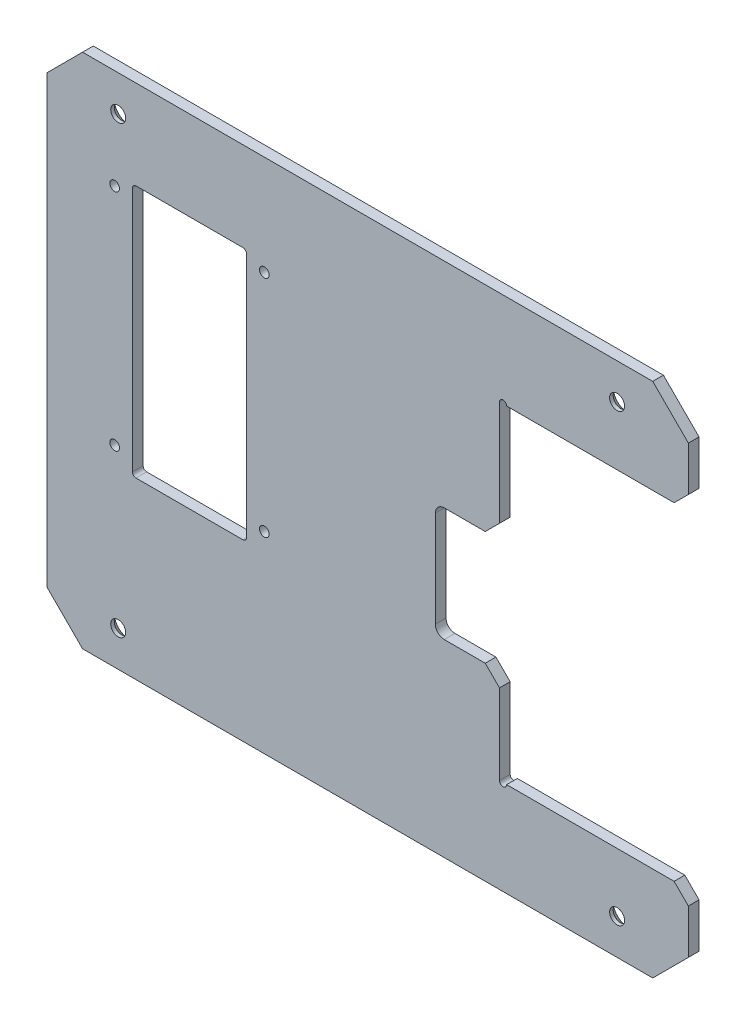
from build123d import *

# Parameters (mm, degrees)
SKETCH_1_W          = 180
SKETCH_1_H          = 145
EXTRUDE_1_DEPTH     = 1.5
SKETCH_2_R          = 2.1
SKETCH_2_W          = 53
SKETCH_2_H          = 92
CUT_EXTRUDE_1_DEPTH = 116.608174451
SKETCH_4_W          = 18
SKETCH_4_H          = 32
CUT_EXTRUDE_3_DEPTH = 116.608174451
SKETCH_3_R          = 1
CUT_EXTRUDE_2_DEPTH = 116.608174451
FILLET_1_R          = 2.5
CHAMFER_1_SIZE      = 2
CHAMFER_2_SIZE      = 10
CHAMFER_3_SIZE      = 4
SKETCH_5_R          = 1.35
SKETCH_5_W          = 32
SKETCH_5_H          = 71
CUT_EXTRUDE_4_DEPTH = 116.608174451
FILLET_2_R          = 1


with BuildPart() as part:
    # 草图1 → 凸台-拉伸1 (new, symmetric)
    with BuildSketch(Plane.XY):
        Rectangle(SKETCH_1_W, SKETCH_1_H)
    extrude(amount=EXTRUDE_1_DEPTH, both=True)

    # 草图2 → 切除-拉伸1 (cut, through all)
    with BuildSketch(Plane.XY.offset(1.5)):
        with Locations((-70, 62.5)):
            Circle(SKETCH_2_R)
        with Locations((-70, -62.5)):
            Circle(SKETCH_2_R)
        with Locations((70, -62.5)):
            Circle(SKETCH_2_R)
        with Locations((70, 62.5)):
            Circle(SKETCH_2_R)
        with Locations((63.5, 0)):
            Rectangle(SKETCH_2_W, SKETCH_2_H)
    extrude(amount=-CUT_EXTRUDE_1_DEPTH, mode=Mode.SUBTRACT)

    # 草图4 → 切除-拉伸3 (cut, through all)
    with BuildSketch(Plane.XY.offset(1.5)):
        with Locations((28, -3.5)):
            Rectangle(SKETCH_4_W, SKETCH_4_H)
    extrude(amount=-CUT_EXTRUDE_3_DEPTH, mode=Mode.SUBTRACT)

    # 草图3 → 切除-拉伸2 (cut, through all)
    with BuildSketch(Plane.XY.offset(1.5)):
        with Locations((38, 46)):
            Circle(SKETCH_3_R)
        with Locations((38, -46)):
            Circle(SKETCH_3_R)
    extrude(amount=-CUT_EXTRUDE_2_DEPTH, mode=Mode.SUBTRACT)

    # 圆角1
    fillet_1_edges = [part.edges().sort_by_distance(p)[0] for p in [
        (19, -19.5, 0),
        (19, 12.5, 0),
    ]]
    fillet(fillet_1_edges, radius=FILLET_1_R)

    # 倒角1
    chamfer_1_edges = [part.edges().sort_by_distance(p)[0] for p in [
        (67.9, 62.5, -1.5),
        (67.9, -62.5, -1.5),
        (-72.1, -62.5, -1.5),
        (-72.1, 62.5, -1.5),
    ]]
    chamfer(chamfer_1_edges, length=CHAMFER_1_SIZE)

    # 倒角2
    chamfer_2_edges = [part.edges().sort_by_distance(p)[0] for p in [
        (-90, 72.5, 0),
        (90, 72.5, 0),
        (90, -72.5, 0),
        (-90, -72.5, 0),
    ]]
    chamfer(chamfer_2_edges, length=CHAMFER_2_SIZE)

    # 倒角3
    chamfer_3_edges = [part.edges().sort_by_distance(p)[0] for p in [
        (90, 46, 0),
        (90, -46, 0),
        (37, 12.5, 0),
        (37, -19.5, 0),
    ]]
    chamfer(chamfer_3_edges, length=CHAMFER_3_SIZE)

    # 草图5 → 切除-拉伸4 (cut, through all)
    with BuildSketch(Plane.XY.offset(1.5)):
        with Locations((-71, 44.5)):
            Circle(SKETCH_5_R)
        with Locations((-29, 44.5)):
            Circle(SKETCH_5_R)
        with Locations((-71, -18.5)):
            Circle(SKETCH_5_R)
        with Locations((-29, -18.5)):
            Circle(SKETCH_5_R)
        with Locations((-50, 12)):
            Rectangle(SKETCH_5_W, SKETCH_5_H)
    extrude(amount=-CUT_EXTRUDE_4_DEPTH, mode=Mode.SUBTRACT)

    # 圆角2
    fillet_2_edges = [part.edges().sort_by_distance(p)[0] for p in [
        (-66, -23.5, 0),
        (-66, 47.5, 0),
        (-34, 47.5, 0),
        (-34, -23.5, 0),
    ]]
    fillet(fillet_2_edges, radius=FILLET_2_R)


solid = part.part
